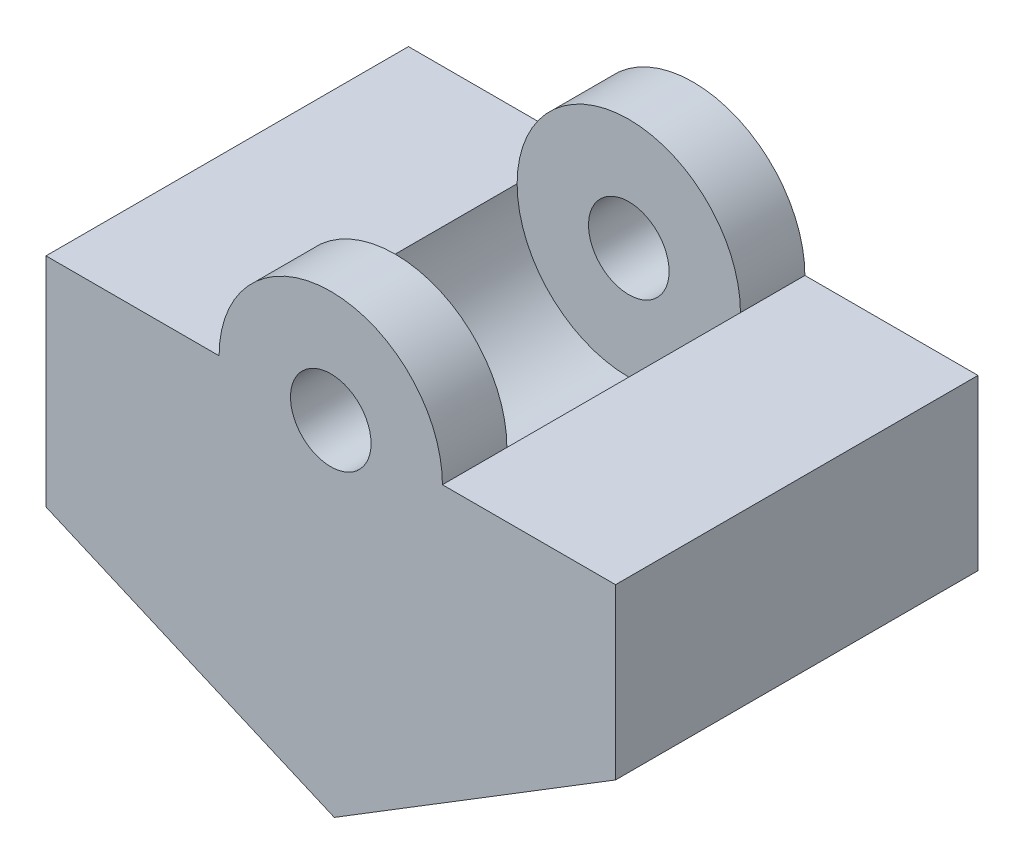
from build123d import *

# Parameters (mm, degrees)
BOSS_EXTRUDE1_DEPTH = 45
CUT_EXTRUDE1_START  = -37
SKETCH3_R           = 13.864092281
CUT_EXTRUDE1_DEPTH  = 29
SKETCH4_R           = 5
CUT_EXTRUDE2_DEPTH  = 81.507898783


with BuildPart() as part:
    # Sketch1 → Boss-Extrude1 (new body)
    with BuildSketch(Plane.XY):
        with BuildLine():
            Line((0, 0), (-35.793601182, 15.486061941))
            Line((-35.793601182, 15.486061941), (-35.793601182, 42.486061941))
            Line((-35.793601182, 42.486061941), (-14.301302797, 42.486061941))
            ThreePointArc((-14.301302797, 42.486061941), (-0.437210516, 56.350154222), (13.426881764, 42.486061941))
            Line((13.426881764, 42.486061941), (34.919180149, 42.486061941))
            Line((34.919180149, 42.486061941), (34.919180149, 21.486061941))
            Line((34.919180149, 21.486061941), (0, 0))
        make_face()
    extrude(amount=BOSS_EXTRUDE1_DEPTH)

    # Sketch3 → Cut-Extrude1 (cut)
    with BuildSketch(Plane.XY.offset(45).offset(CUT_EXTRUDE1_START)):
        with Locations((-0.437210516, 42.486061941)):
            Circle(SKETCH3_R)
    extrude(amount=CUT_EXTRUDE1_DEPTH, mode=Mode.SUBTRACT)

    # Sketch4 → Cut-Extrude2 (cut, through all)
    with BuildSketch(Plane.XY.offset(45)):
        with Locations((-0.437210516, 42.486061941)):
            Circle(SKETCH4_R)
    extrude(amount=-CUT_EXTRUDE2_DEPTH, mode=Mode.SUBTRACT)


solid = part.part
